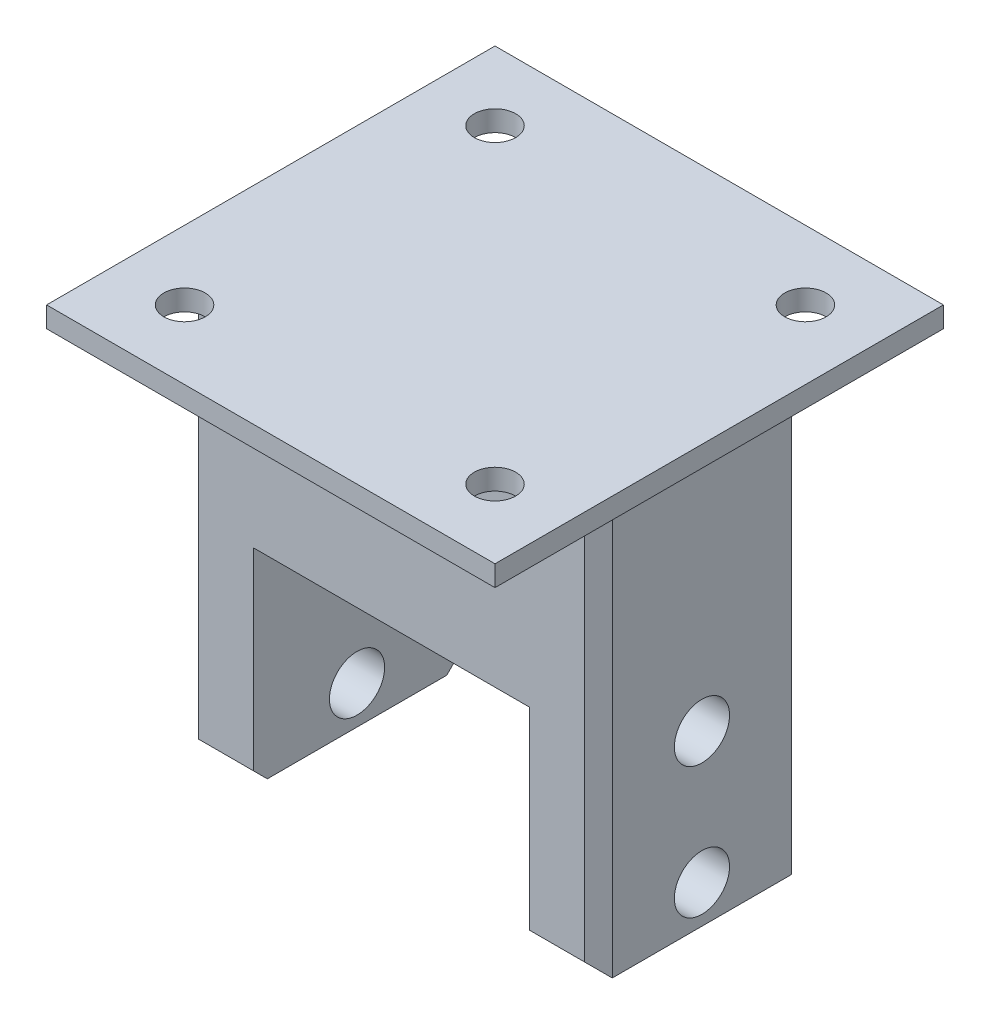
from build123d import *

# Parameters (mm, degrees)
EXTRUDE_1_DEPTH     = 30
SKETCH_2_R          = 4
CUT_EXTRUDE_1_DEPTH = 74.484692283
SKETCH_3_W          = 65
SKETCH_3_H          = 65
SKETCH_3_R          = 3
EXTRUDE_2_DEPTH     = 3
CHAMFER_2_SIZE      = 2


with BuildPart() as part:
    # 草图1 → 凸台-拉伸1 (new body)
    with BuildSketch(Plane.XY):
        Polygon((-30, -30), (-20, -30), (-20, 0), (20, 0), (20, -30), (30, -30), (30, 30), (-30, 30), align=None)
    extrude(amount=EXTRUDE_1_DEPTH)

    # 草图2 → 切除-拉伸1 (cut, through all)
    with BuildSketch(Plane.ZY.offset(30)):
        with Locations((15, -5.5)):
            Circle(SKETCH_2_R)
        with Locations((15, -24.5)):
            Circle(SKETCH_2_R)
    extrude(amount=-CUT_EXTRUDE_1_DEPTH, mode=Mode.SUBTRACT)

    # 草图3 → 凸台-拉伸2 (add)
    with BuildSketch(Plane(origin=(0, 30, 0), x_dir=(1, 0, 0), z_dir=(0, 1, 0))):
        with Locations((0, -15)):
            Rectangle(SKETCH_3_W, SKETCH_3_H)
        with Locations(Location((22.5, -37.5, 0), (0, 0, 270))):
            Circle(SKETCH_3_R, mode=Mode.SUBTRACT)
        with Locations(Location((-22.5, -37.5, 0), (0, 0, 270))):
            Circle(SKETCH_3_R, mode=Mode.SUBTRACT)
        with Locations(Location((-22.5, 7.5, 0), (0, 0, 270))):
            Circle(SKETCH_3_R, mode=Mode.SUBTRACT)
        with Locations(Location((22.5, 7.5, 0), (0, 0, 270))):
            Circle(SKETCH_3_R, mode=Mode.SUBTRACT)
    extrude(amount=EXTRUDE_2_DEPTH)

    # 倒角2
    chamfer_2_edges = [part.edges().sort_by_distance(p)[0] for p in [
        (-25, -30, 0),
        (-30, 0, 0),
        (25, -30, 30),
        (30, 0, 30),
        (-30, 0, 30),
        (-25, -30, 30),
        (30, 0, 0),
        (25, -30, 0),
    ]]
    chamfer(chamfer_2_edges, length=CHAMFER_2_SIZE)


solid = part.part
